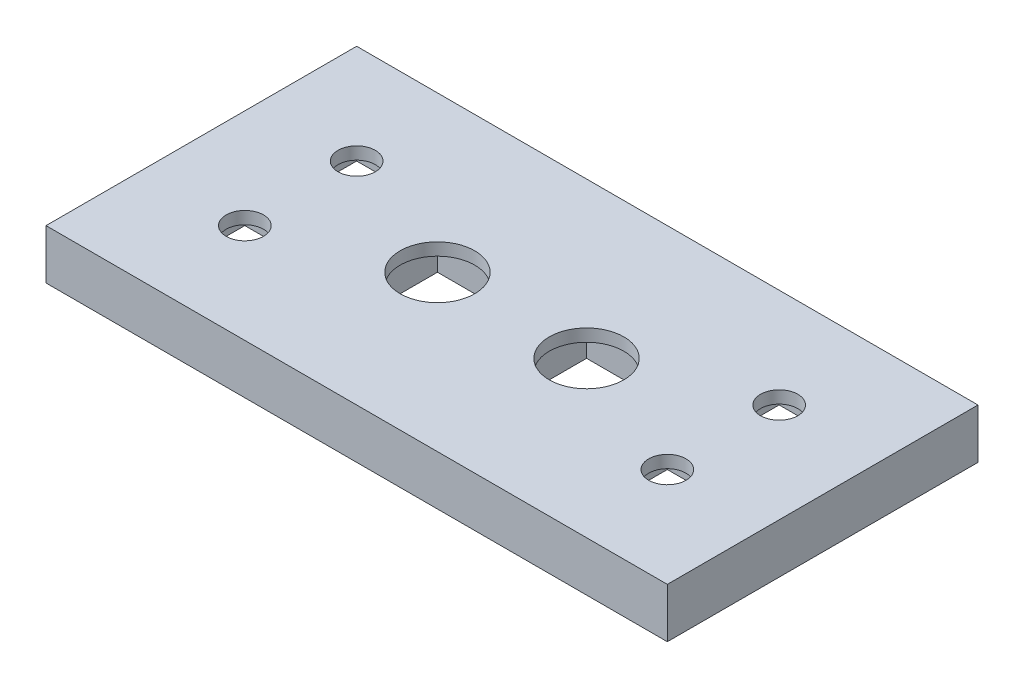
from build123d import *

# Parameters (mm, degrees)
SKETCH1_W           = 50
SKETCH1_H           = 25
BOSS_EXTRUDE1_DEPTH = 4
SKETCH1_3_W         = 8
SKETCH1_3_H         = 8
SKETCH1_3_R         = 1.5
SKETCH1_3_R_2       = 3
CUT_EXTRUDE3_DEPTH  = 3
SKETCH1_4_R         = 1.5
SKETCH1_4_R_2       = 3
CUT_EXTRUDE4_DEPTH  = 57.044625077


with BuildPart() as part:
    # Sketch1 → Boss-Extrude1 (new body)
    with BuildSketch(Plane(origin=(0, 0, 0), x_dir=(1, 0, 0), z_dir=(0, 1, 0))):
        with Locations((25, 12.5)):
            Rectangle(SKETCH1_W, SKETCH1_H)
    extrude(amount=BOSS_EXTRUDE1_DEPTH)

    # Sketch1<3> → Cut-Extrude3 (cut)
    # profile 1 of 6: a face of its own
    with BuildSketch(Plane(origin=(0, 0, 0), x_dir=(1, 0, 0), z_dir=(0, 1, 0))):
        with Locations((8, 8)):
            Rectangle(SKETCH1_3_W, SKETCH1_3_H)
        with Locations((8, 8)):
            Circle(SKETCH1_3_R, mode=Mode.SUBTRACT)
    # profile 2 of 6: a face of its own
    with BuildSketch(Plane(origin=(0, 0, 0), x_dir=(1, 0, 0), z_dir=(0, 1, 0))):
        with Locations((19, 12.5)):
            Rectangle(SKETCH1_3_W, SKETCH1_3_H)
    # profile 3 of 6: a face of its own
    with BuildSketch(Plane(origin=(0, 0, 0), x_dir=(1, 0, 0), z_dir=(0, 1, 0))):
        with Locations((8, 17)):
            Rectangle(SKETCH1_3_W, SKETCH1_3_H)
    # profile 4 of 6: a face of its own
    with BuildSketch(Plane(origin=(0, 0, 0), x_dir=(1, 0, 0), z_dir=(0, 1, 0))):
        with Locations((31, 12.5)):
            Rectangle(SKETCH1_3_W, SKETCH1_3_H)
        with Locations((31, 12.5)):
            Circle(SKETCH1_3_R_2, mode=Mode.SUBTRACT)
    # profile 5 of 6: a face of its own
    with BuildSketch(Plane(origin=(0, 0, 0), x_dir=(1, 0, 0), z_dir=(0, 1, 0))):
        with Locations((42, 8)):
            Rectangle(SKETCH1_3_W, SKETCH1_3_H)
        with Locations((42, 8)):
            Circle(SKETCH1_3_R, mode=Mode.SUBTRACT)
    # profile 6 of 6: a face of its own
    with BuildSketch(Plane(origin=(0, 0, 0), x_dir=(1, 0, 0), z_dir=(0, 1, 0))):
        with Locations((42, 17)):
            Rectangle(SKETCH1_3_W, SKETCH1_3_H)
        with Locations((42, 17)):
            Circle(SKETCH1_3_R, mode=Mode.SUBTRACT)
    extrude(amount=CUT_EXTRUDE3_DEPTH, mode=Mode.SUBTRACT)

    # Sketch1<4> → Cut-Extrude4 (cut, through all)
    with BuildSketch(Plane(origin=(0, 0, 0), x_dir=(1, 0, 0), z_dir=(0, 1, 0))):
        with Locations((8, 17)):
            Circle(SKETCH1_4_R)
        with Locations((19, 12.5)):
            Circle(SKETCH1_4_R_2)
        with Locations((8, 8)):
            Circle(SKETCH1_4_R)
        with Locations((31, 12.5)):
            Circle(SKETCH1_4_R_2)
        with Locations((42, 8)):
            Circle(SKETCH1_4_R)
        with Locations((42, 17)):
            Circle(SKETCH1_4_R)
    extrude(amount=CUT_EXTRUDE4_DEPTH, mode=Mode.SUBTRACT)


solid = part.part
